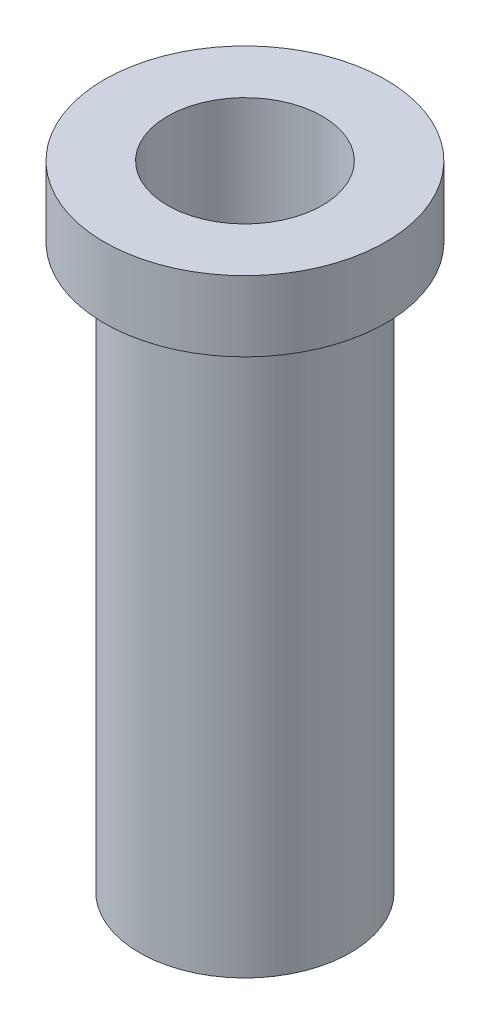
from build123d import *


with BuildPart() as part:
    # Sketch1 → Revolve1 (revolve)
    with BuildSketch(Plane.XY, mode=Mode.PRIVATE) as revolve1_sk:
        Polygon((5.5, 21.566592845), (5.5, -23.433407155), (7.5, -23.433407155), (7.5, 16.566592845), (10, 16.566592845), (10, 21.566592845), align=None)
    revolve(revolve1_sk.sketch.rotate(Axis((0, 21.566592845, 0), (0, -1, 0)), 180), axis=Axis((0, 21.566592845, 0), (0, -1, 0)))


solid = part.part
